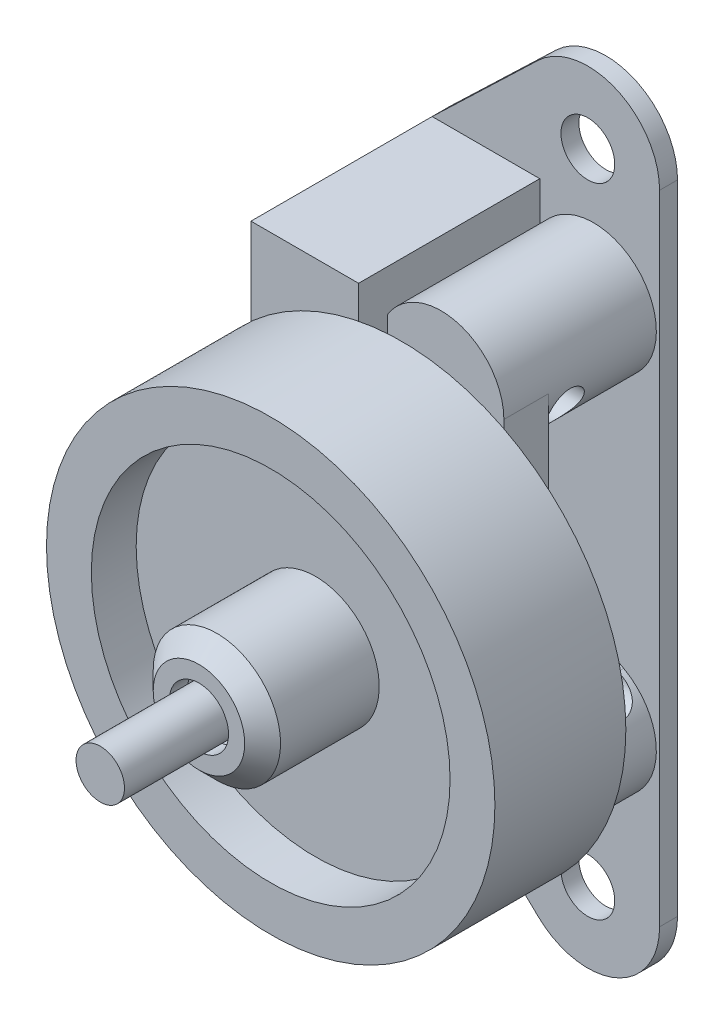
from build123d import *

# Parameters (mm, degrees)
SKETCH1_R            = 4
SKETCH1_R_2          = 1.5
BOSS_EXTRUDE1_DEPTH  = 1
BOSS_EXTRUDE2_START  = -1
BOSS_EXTRUDE2_DEPTH  = 1
SKETCH3_W            = 6
SKETCH3_H            = 8.25
SKETCH3_H_2          = 11.25
BOSS_EXTRUDE3_DEPTH  = 7.1
BOSS_EXTRUDE4_DEPTH  = 6
SKETCH5_R            = 3.5
BOSS_EXTRUDE5_DEPTH  = 1.5
SKETCH4_3_R          = 2.1
CUT_EXTRUDE1_DEPTH   = 12
SKETCH6_R            = 1
CUT_EXTRUDE2_DEPTH   = 13
SKETCH7_R            = 3.7
BOSS_EXTRUDE6_DEPTH  = 3.2
SKETCH8_R            = 12.5
BOSS_EXTRUDE7_DEPTH  = 7.3
SKETCH9_R            = 2
BOSS_EXTRUDE8_DEPTH  = 1.8
SKETCH10_R           = 1.35
BOSS_EXTRUDE9_DEPTH  = 7.7
BOSS_EXTRUDE10_DEPTH = 2
BOSS_EXTRUDE11_DEPTH = 6
SKETCH14_R           = 1
CUT_EXTRUDE3_DEPTH   = 42.819473933
BOSS_EXTRUDE12_DEPTH = 1.5
SKETCH16_R           = 2.1
BOSS_EXTRUDE13_DEPTH = 0.2
SKETCH17_R           = 2.1
BOSS_EXTRUDE14_DEPTH = 1
SKETCH18_W           = 6
SKETCH18_H           = 11.25
SKETCH18_H_2         = 8.25
BOSS_EXTRUDE15_DEPTH = 1
SKETCH19_R           = 10
SKETCH19_R_2         = 2
CUT_EXTRUDE4_DEPTH   = 2.5
SKETCH20_R           = 3.55
SKETCH20_R_2         = 2.25
BOSS_EXTRUDE16_DEPTH = 6.5
SKETCH21_R           = 2.25
SKETCH21_R_2         = 1.65
BOSS_EXTRUDE17_DEPTH = 1
CHAMFER1_SIZE        = 1


with BuildPart() as part:
    # Sketch1 → Boss-Extrude1 (new body)
    # profile 1 of 3: a face of its own
    with BuildSketch(Plane.XY):
        with BuildLine():
            Line((47.18, -17.78), (47.18, 17.78))
            ThreePointArc((47.18, 17.78), (43.18, 13.78), (39.18, 17.78))
            Line((39.18, 17.78), (39.18, -17.78))
            ThreePointArc((39.18, -17.78), (43.18, -13.78), (47.18, -17.78))
        make_face()
    # profile 2 of 3: a face of its own
    with BuildSketch(Plane.XY):
        with Locations((43.18, 17.78)):
            Circle(SKETCH1_R)
        with Locations((43.18, 17.78)):
            Circle(SKETCH1_R_2, mode=Mode.SUBTRACT)
    # profile 3 of 3: a face of its own
    with BuildSketch(Plane.XY):
        with Locations((43.18, -17.78)):
            Circle(SKETCH1_R)
        with Locations((43.18, -17.78)):
            Circle(SKETCH1_R_2, mode=Mode.SUBTRACT)
    extrude(amount=BOSS_EXTRUDE1_DEPTH)

    # Sketch2 → Boss-Extrude2 (add)
    with BuildSketch(Plane.XY.offset(1).offset(BOSS_EXTRUDE2_START)):
        with BuildLine():
            ThreePointArc((39.18, 17.78), (39.500839476, 19.349642584), (40.41188892, 20.667483515))
            Line((40.41188892, 20.667483515), (34.5, 15))
            Line((34.5, 15), (34.5, 0))
            Line((34.5, 0), (39.18, 0))
            Line((39.18, 0), (39.18, 17.78))
        make_face()
        with BuildLine():
            Line((39.18, 0), (34.5, 0))
            Line((34.5, 0), (34.5, -15))
            Line((34.5, -15), (40.41188892, -20.667483515))
            ThreePointArc((40.41188892, -20.667483515), (39.500839476, -19.349642584), (39.18, -17.78))
            Line((39.18, -17.78), (39.18, 0))
        make_face()
    extrude(amount=BOSS_EXTRUDE2_DEPTH)

    # Sketch3 → Boss-Extrude3 (add)
    with BuildSketch(Plane.XY.offset(1)):
        with Locations((37.5, 10.875)):
            Rectangle(SKETCH3_W, SKETCH3_H)
        with Locations((37.5, -9.375)):
            Rectangle(SKETCH3_W, SKETCH3_H_2)
    extrude(amount=BOSS_EXTRUDE3_DEPTH)

    # Sketch4 → Boss-Extrude4 (add)
    with BuildSketch(Plane.XY.offset(1)):
        with BuildLine():
            ThreePointArc((40.5, 9.072224362), (44.435414347, 7.502315609), (47, 10.875))
            ThreePointArc((47, 10.875), (44.435414347, 14.247684391), (40.5, 12.677775638))
            Line((40.5, 12.677775638), (40.5, 9.072224362))
        make_face()
        with BuildLine():
            Line((40.5, 9.072224362), (40.5, 12.677775638))
            ThreePointArc((40.5, 12.677775638), (40, 10.875), (40.5, 9.072224362))
        make_face()
        with BuildLine():
            ThreePointArc((40.5, -11.177775638), (44.435414347, -12.747684391), (47, -9.375))
            ThreePointArc((47, -9.375), (44.435414347, -6.002315609), (40.5, -7.572224362))
            Line((40.5, -7.572224362), (40.5, -11.177775638))
        make_face()
        with BuildLine():
            Line((40.5, -11.177775638), (40.5, -7.572224362))
            ThreePointArc((40.5, -7.572224362), (40, -9.375), (40.5, -11.177775638))
        make_face()
    extrude(amount=BOSS_EXTRUDE4_DEPTH)

    # Sketch5 → Boss-Extrude5 (add)
    with BuildSketch(Plane.XY.offset(7)):
        with BuildLine():
            ThreePointArc((40.5, 9.072224362), (47, 10.875), (40.5, 12.677775638))
            Line((40.5, 12.677775638), (40.5, 9.072224362))
        make_face()
        with BuildLine():
            Line((47, -9.375), (47, 10.875))
            ThreePointArc((47, 10.875), (44.435414347, 7.502315609), (40.5, 9.072224362))
            ThreePointArc((40.5, 9.072224362), (40.127315609, 9.939585653), (40, 10.875))
            Line((40, 10.875), (40, -9.375))
            ThreePointArc((40, -9.375), (43.5, -5.875), (47, -9.375))
        make_face()
        with Locations((43.5, -9.375)):
            Circle(SKETCH5_R)
    extrude(amount=BOSS_EXTRUDE5_DEPTH)

    # Sketch4<3> → Cut-Extrude1 (cut)
    with BuildSketch(Plane.XY.offset(1)):
        with Locations((43.5, 1.5)):
            Circle(SKETCH4_3_R)
    extrude(amount=CUT_EXTRUDE1_DEPTH, mode=Mode.SUBTRACT)

    # Sketch6 → Cut-Extrude2 (cut)
    with BuildSketch(Plane.ZY.offset(-34.5)):
        with Locations((5.8, 9.5)):
            Circle(SKETCH6_R)
        with Locations((2.3, -6.5)):
            Circle(SKETCH6_R)
    extrude(amount=-CUT_EXTRUDE2_DEPTH, mode=Mode.SUBTRACT)

    # Sketch11 → Boss-Extrude10 (add)
    with BuildSketch(Plane.XY.offset(8.1)):
        Polygon((40, -3.75), (34.5, -3.75), (34.5, -15), (40, -15), (40, -9.375), align=None)
        with BuildLine():
            Line((40, -9.375), (40, -15))
            Line((40, -15), (40.5, -15))
            Line((40.5, -15), (40.5, -11.177775638))
            ThreePointArc((40.5, -11.177775638), (40.127315609, -10.310414347), (40, -9.375))
        make_face()
        with BuildLine():
            Line((40.5, -3.75), (40, -3.75))
            Line((40, -3.75), (40, -9.375))
            ThreePointArc((40, -9.375), (40.127315609, -10.310414347), (40.5, -11.177775638))
            Line((40.5, -11.177775638), (40.5, -3.75))
        make_face()
        Polygon((34.5, 6.75), (40, 6.75), (40, 10.875), (40, 15), (34.5, 15), align=None)
        with BuildLine():
            Line((40, 10.875), (40, 6.75))
            Line((40, 6.75), (40.5, 6.75))
            Line((40.5, 6.75), (40.5, 9.072224362))
            ThreePointArc((40.5, 9.072224362), (40.127315609, 9.939585653), (40, 10.875))
        make_face()
        with BuildLine():
            Line((40, 15), (40, 10.875))
            ThreePointArc((40, 10.875), (40.127315609, 9.939585653), (40.5, 9.072224362))
            Line((40.5, 9.072224362), (40.5, 12.677775638))
            Line((40.5, 12.677775638), (40.5, 15))
            Line((40.5, 15), (40, 15))
        make_face()
    extrude(amount=BOSS_EXTRUDE10_DEPTH)

    # Sketch13 → Boss-Extrude11 (add)
    with BuildSketch(Plane.XY.offset(1)):
        with BuildLine():
            Line((45.176908715, -6.302870907), (40.5, -3.75))
            Line((40.5, -3.75), (40.5, -7.572224362))
            ThreePointArc((40.5, -7.572224362), (42.58323548, -5.997198523), (45.176908715, -6.302870907))
        make_face()
        with BuildLine():
            Line((40.5, 9.072224362), (40.5, 6.75))
            Line((40.5, 6.75), (44.146384325, 7.43520534))
            ThreePointArc((44.146384325, 7.43520534), (42.066530605, 7.682013077), (40.5, 9.072224362))
        make_face()
    extrude(amount=BOSS_EXTRUDE11_DEPTH)

    # Sketch14 → Cut-Extrude3 (cut, through all)
    with BuildSketch(Plane.ZY.offset(-34.5)):
        with Locations((5.8, 9.5)):
            Circle(SKETCH14_R)
        with Locations((2.3, -6.5)):
            Circle(SKETCH14_R)
    extrude(amount=-CUT_EXTRUDE3_DEPTH, mode=Mode.SUBTRACT)

    # Sketch15 → Boss-Extrude12 (add)
    with BuildSketch(Plane.XY.offset(8.5)):
        with BuildLine():
            Line((40, -2.070714214), (40, 5.070714214))
            ThreePointArc((40, 5.070714214), (38.5, 1.5), (40, -2.070714214))
        make_face()
    extrude(amount=-BOSS_EXTRUDE12_DEPTH)

    # Sketch16 → Boss-Extrude13 (add)
    with BuildSketch(Plane(origin=(0, 0, 7), x_dir=(-1, 0, 0), z_dir=(0, 0, -1))):
        with Locations((-43.5, 1.5)):
            Circle(SKETCH16_R)
    extrude(amount=-BOSS_EXTRUDE13_DEPTH)

    # Sketch17 → Boss-Extrude14 (add)
    with BuildSketch(Plane.XY.offset(8.5)):
        with BuildLine():
            Line((40.5, 12.677775638), (40.5, 6.75))
            Line((40.5, 6.75), (40, 6.75))
            Line((40, 6.75), (40, 5.070714214))
            ThreePointArc((40, 5.070714214), (38.5, 1.5), (40, -2.070714214))
            Line((40, -2.070714214), (40, -3.75))
            Line((40, -3.75), (40.5, -3.75))
            Line((40.5, -3.75), (40.5, -11.177775638))
            ThreePointArc((40.5, -11.177775638), (44.435414347, -12.747684391), (47, -9.375))
            Line((47, -9.375), (47, 10.875))
            ThreePointArc((47, 10.875), (44.435414347, 14.247684391), (40.5, 12.677775638))
        make_face()
        with Locations(Location((43.5, 1.5, 0), (0, 0, 180))):
            Circle(SKETCH17_R, mode=Mode.SUBTRACT)
    extrude(amount=BOSS_EXTRUDE14_DEPTH)

    # Sketch18 → Boss-Extrude15 (add)
    with BuildSketch(Plane.XY.offset(10.1)):
        with Locations((37.5, -9.375)):
            Rectangle(SKETCH18_W, SKETCH18_H)
        with Locations((37.5, 10.875)):
            Rectangle(SKETCH18_W, SKETCH18_H_2)
    extrude(amount=BOSS_EXTRUDE15_DEPTH)


with BuildPart() as body_2:
    # Sketch7 → Boss-Extrude6 (new body)
    with BuildSketch(Plane.XY.offset(8.5)):
        with Locations((43.5, 1.5)):
            Circle(SKETCH7_R)
    extrude(amount=BOSS_EXTRUDE6_DEPTH)

    # Sketch8 → Boss-Extrude7 (add)
    with BuildSketch(Plane.XY.offset(11.7)):
        with Locations((43.5, 1.5)):
            Circle(SKETCH8_R)
    extrude(amount=BOSS_EXTRUDE7_DEPTH)

    # Sketch9 → Boss-Extrude8 (add)
    with BuildSketch(Plane.XY.offset(19)):
        with Locations((43.5, 1.5)):
            Circle(SKETCH9_R)
    extrude(amount=BOSS_EXTRUDE8_DEPTH)

    # Sketch10 → Boss-Extrude9 (add)
    with BuildSketch(Plane.XY.offset(20.8)):
        with Locations(Location((43.5, 1.5, 0), (0, 0, 180))):
            Circle(SKETCH10_R)
    extrude(amount=BOSS_EXTRUDE9_DEPTH)

    # Sketch19 → Cut-Extrude4 (cut)
    with BuildSketch(Plane.XY.offset(19)):
        with Locations((43.5, 1.5)):
            Circle(SKETCH19_R)
        with Locations((43.5, 1.5)):
            Circle(SKETCH19_R_2, mode=Mode.SUBTRACT)
    extrude(amount=-CUT_EXTRUDE4_DEPTH, mode=Mode.SUBTRACT)


with BuildPart() as body_3:
    # Sketch20 → Boss-Extrude16 (new body)
    with BuildSketch(Plane.XY.offset(16.5)):
        with Locations(Location((43.5, 1.5, 0), (0, 0, 180))):
            Circle(SKETCH20_R)
        with Locations(Location((43.5, 1.5, 0), (0, 0, 180))):
            Circle(SKETCH20_R_2, mode=Mode.SUBTRACT)
    extrude(amount=BOSS_EXTRUDE16_DEPTH)

    # Sketch21 → Boss-Extrude17 (add)
    with BuildSketch(Plane.XY.offset(23)):
        with Locations(Location((43.5, 1.5, 0), (0, 0, 180))):
            Circle(SKETCH21_R)
        with Locations((43.5, 1.5)):
            Circle(SKETCH21_R_2, mode=Mode.SUBTRACT)
    extrude(amount=-BOSS_EXTRUDE17_DEPTH)

    # Chamfer1
    chamfer1_edges = [body_3.edges().sort_by_distance(p)[0] for p in [
        (47.05, 1.5, 23),
    ]]
    chamfer(chamfer1_edges, length=CHAMFER1_SIZE)


solid = Compound([part.part, body_2.part, body_3.part])
